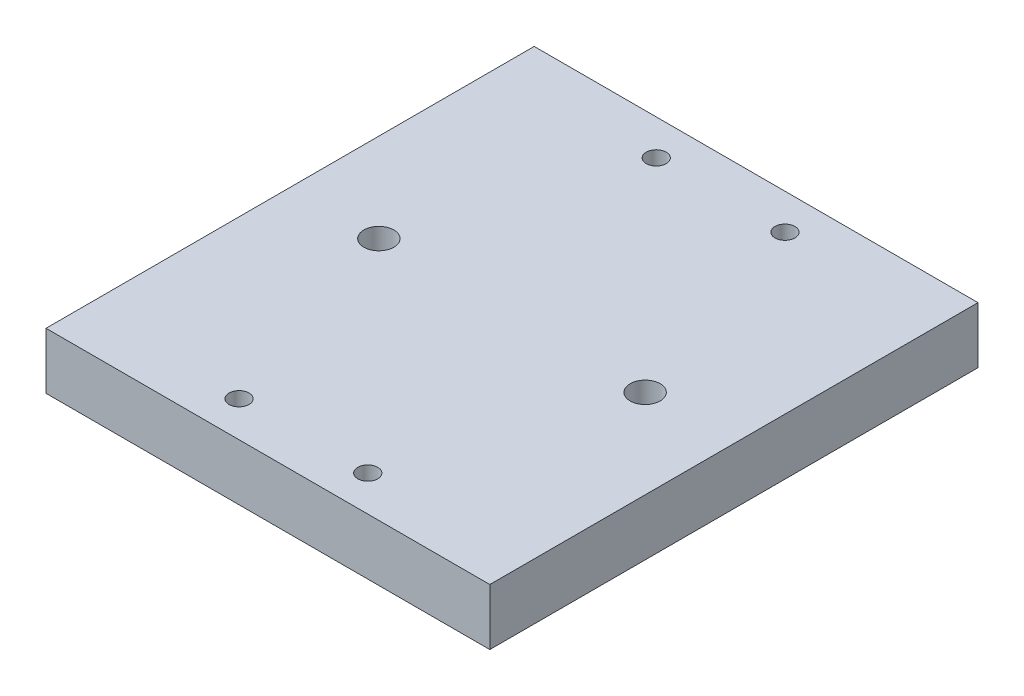
from build123d import *

# Parameters (mm, degrees)
SKETCH1_W                                        = 100
SKETCH1_H                                        = 12.7
BOSS_EXTRUDE1_DEPTH                              = 55
M4_CLEARANCE_HOLE1_D                             = 4.5
CBORE_FOR_1_4_SOCKET_HEAD_CAP_SCREW1_D           = 6.7564
CBORE_FOR_1_4_SOCKET_HEAD_CAP_SCREW1_CBORE_D     = 11.1125
CBORE_FOR_1_4_SOCKET_HEAD_CAP_SCREW1_CBORE_DEPTH = 6.35


with BuildPart() as part:
    # Sketch1 → Boss-Extrude1 (new, symmetric)
    with BuildSketch(Plane.XY):
        Rectangle(SKETCH1_W, SKETCH1_H)
    extrude(amount=BOSS_EXTRUDE1_DEPTH, both=True)

    # M4 Clearance Hole1 (through all)
    with Locations(Plane(origin=(0, 6.35, 0), x_dir=(1, 0, 0), z_dir=(0, 1, 0))):
        with Locations((14.5, -47), (-14.5, -47), (-14.5, 47), (14.5, 47)):
            Hole(M4_CLEARANCE_HOLE1_D / 2)

    # CBORE for 1/4 Socket Head Cap Screw1 (through all)
    with Locations(Plane(origin=(0, -6.35, 0), x_dir=(-1, 0, 0), z_dir=(0, -1, 0))):
        with Locations((30.000007891, 1.671e-06), (-29.999992109, 1.671e-06)):
            CounterBoreHole(CBORE_FOR_1_4_SOCKET_HEAD_CAP_SCREW1_D / 2, CBORE_FOR_1_4_SOCKET_HEAD_CAP_SCREW1_CBORE_D / 2, CBORE_FOR_1_4_SOCKET_HEAD_CAP_SCREW1_CBORE_DEPTH)


solid = part.part
